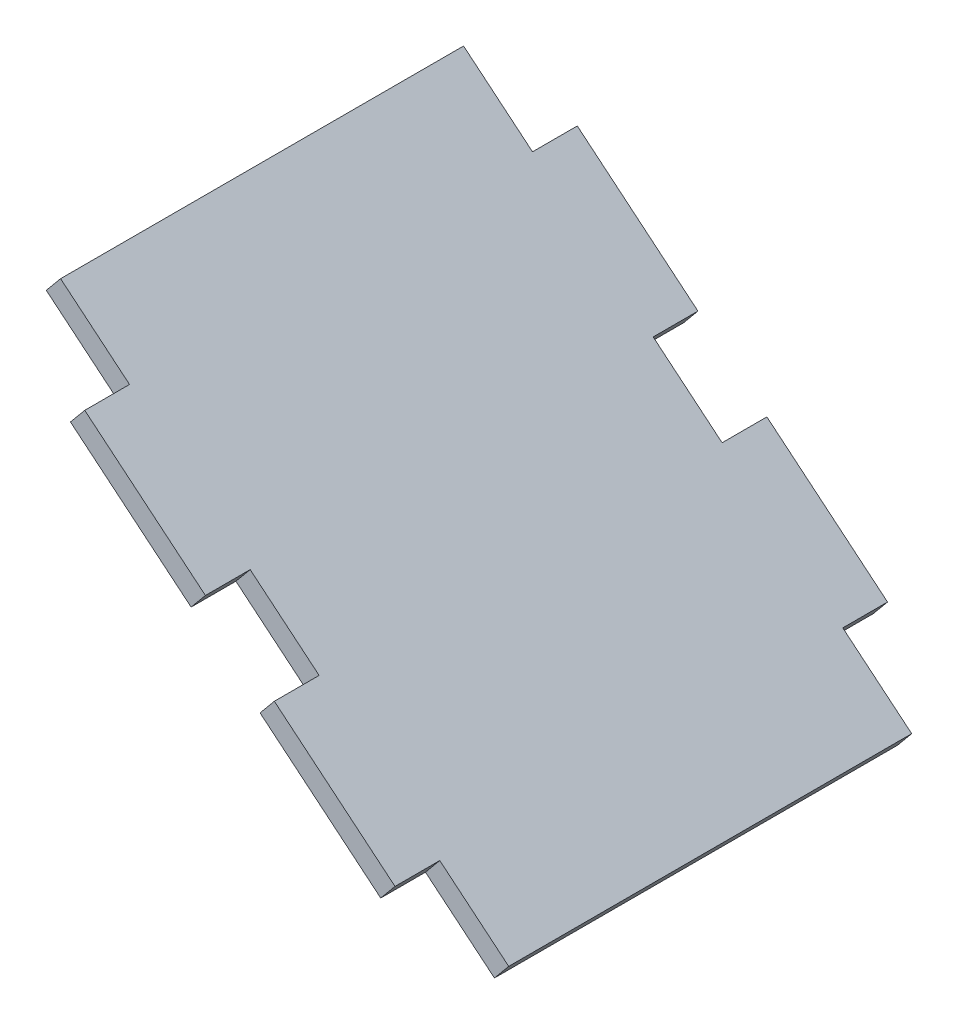
from build123d import *

# Parameters (mm, degrees)
BOSS_EXTRUDE1_DEPTH = 69.85
SKETCH2_W           = 12.7
SKETCH2_H           = 6.35
CUT_EXTRUDE1_DEPTH  = 222.192263369


with BuildPart() as part:
    # Sketch1 → Boss-Extrude1 (new body)
    with BuildSketch(Plane.XY):
        Polygon((503.990679128, 281.590154943), (440.437020728, 334.27255242), (442.463266785, 336.716923897), (506.016925185, 284.03452642), align=None)
    extrude(amount=-BOSS_EXTRUDE1_DEPTH)

    # Sketch2 → Cut-Extrude1 (cut, through all)
    with BuildSketch(Plane(origin=(345.646636579, 416.972448493, 0), x_dir=(0.7698807801393573, -0.6381877344261755, 0), z_dir=(0.6381877344261755, 0.7698807801393575, 0))):
        with Locations((132.10535421, 66.675)):
            Rectangle(SKETCH2_W, SKETCH2_H)
        with Locations((167.03035421, 66.675)):
            Rectangle(SKETCH2_W, SKETCH2_H)
        with Locations((201.95535421, 66.675)):
            Rectangle(SKETCH2_W, SKETCH2_H)
        with Locations((132.10535421, 3.175)):
            Rectangle(SKETCH2_W, SKETCH2_H)
        with Locations((167.03035421, 3.175)):
            Rectangle(SKETCH2_W, SKETCH2_H)
        with Locations((201.95535421, 3.175)):
            Rectangle(SKETCH2_W, SKETCH2_H)
    extrude(amount=-CUT_EXTRUDE1_DEPTH, mode=Mode.SUBTRACT)


solid = part.part
